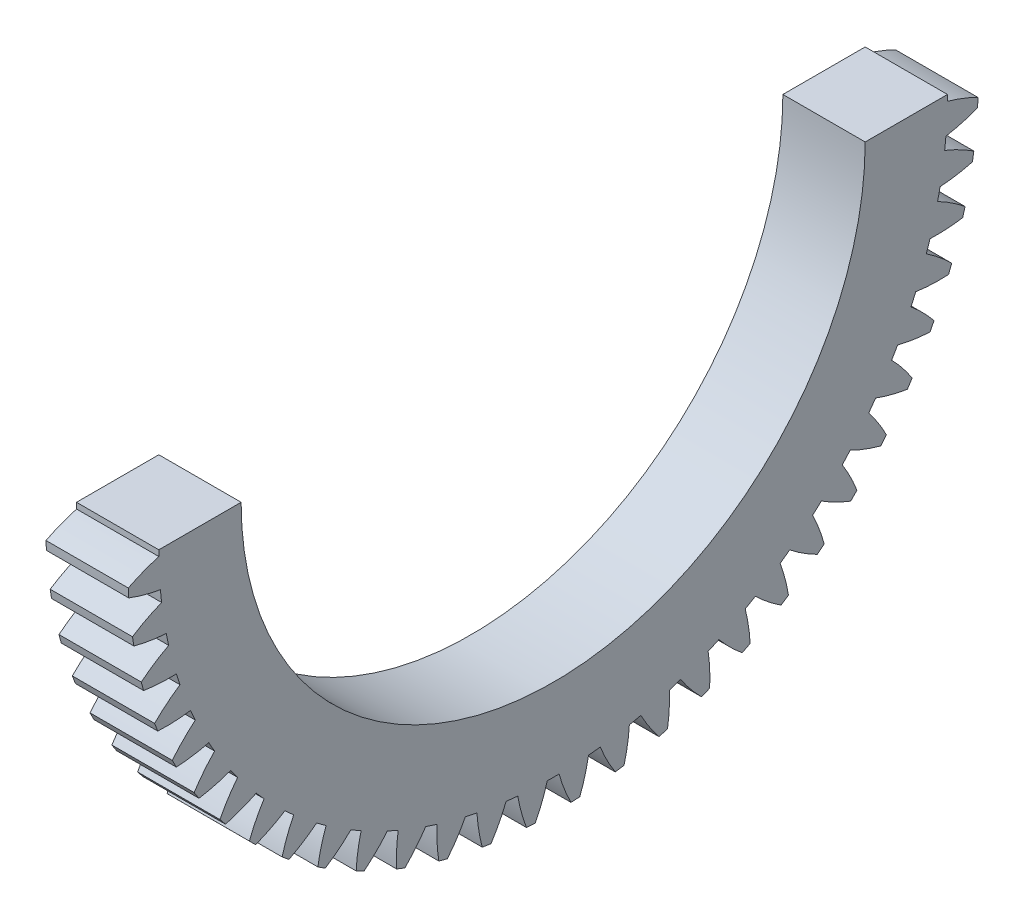
from build123d import *

# Parameters (mm, degrees)
BASPROSKE_W             = 3
BASPROSKE_H             = 15.5
TOOTHCUT_DEPTH          = 23.12464689
TEETHCUTS_COUNT         = 60
TEETHCUTS_ANGLE         = 354
BORSKE_R                = 13
BORE_DEPTH              = 50.0000508
CROQUIS1_W              = 35.088386171
CROQUIS1_H              = 16.253421715
CORTAR_EXTRUIR1_DEPTH   = 23.10554405
SALIENTE_EXTRUIR1_DEPTH = 3


with BuildPart() as part:
    # BasProSke → Base-Revolve (revolve)
    with BuildSketch(Plane(origin=(0, 0, 0), x_dir=(1, 0, 0), z_dir=(0, 1, 0)), mode=Mode.PRIVATE) as base_revolve_sk:
        with Locations((1.5, 7.75)):
            Rectangle(BASPROSKE_W, BASPROSKE_H)
    revolve(base_revolve_sk.sketch.rotate(Axis((-10, 0, 0), (1, 0, 0)), 180), axis=Axis((-10, 0, 0), (1, 0, 0)))

    # TooCutSke → ToothCut (cut, through all)
    with BuildSketch(Plane(origin=(0, 0, 0), x_dir=(0, 0, -1), z_dir=(1, 0, 0))):
        with BuildLine():
            ThreePointArc((0.21493681, 14.372392917), (0, 14.374), (-0.21493681, 14.372392917))
            ThreePointArc((-0.21493681, 14.372392917), (-0.409732631, 14.953266942), (-0.662749221, 15.51124781))
            ThreePointArc((-0.662749221, 15.51124781), (0, 15.5254), (0.662749221, 15.51124781))
            ThreePointArc((0.662749221, 15.51124781), (0.409732631, 14.953266942), (0.21493681, 14.372392917))
        make_face()
    toothcut = extrude(amount=TOOTHCUT_DEPTH, mode=Mode.SUBTRACT)

    # TeethCuts: ToothCut ×60 about axis
    teethcuts_axis = Axis((-10, 0, 0), (1, 0, 0))
    for i in range(1, TEETHCUTS_COUNT):
        add(toothcut.rotate(teethcuts_axis, i * TEETHCUTS_ANGLE / (TEETHCUTS_COUNT - 1)), mode=Mode.SUBTRACT)

    # BorSke → Bore (cut, symmetric)
    with BuildSketch(Plane(origin=(0, 0, 0), x_dir=(0, 0, -1), z_dir=(1, 0, 0))):
        with Locations(Location((0, 0, 0), (0, 0, 180))):
            Circle(BORSKE_R)
    extrude(amount=BORE_DEPTH, both=True, mode=Mode.SUBTRACT)

    # Croquis1 → Cortar-Extruir1 (cut, through all)
    with BuildSketch(Plane(origin=(3, 0, 0), x_dir=(0, 0, -1), z_dir=(1, 0, 0))):
        with Locations((0.283547397, 8.126710858)):
            Rectangle(CROQUIS1_W, CROQUIS1_H)
    extrude(amount=-CORTAR_EXTRUIR1_DEPTH, mode=Mode.SUBTRACT)

    # Croquis2 → Saliente-Extruir1 (add, through all)
    with BuildSketch(Plane(origin=(3, 0, 0), x_dir=(0, 0, -1), z_dir=(1, 0, 0))):
        with BuildLine():
            Line((-13, 0), (-11.374, 0))
            ThreePointArc((-11.374, 0), (0, -11.374), (11.374, 0))
            Line((11.374, 0), (13, 0))
            ThreePointArc((13, 0), (0, -13), (-13, 0))
        make_face()
    extrude(amount=-SALIENTE_EXTRUIR1_DEPTH)


solid = part.part
